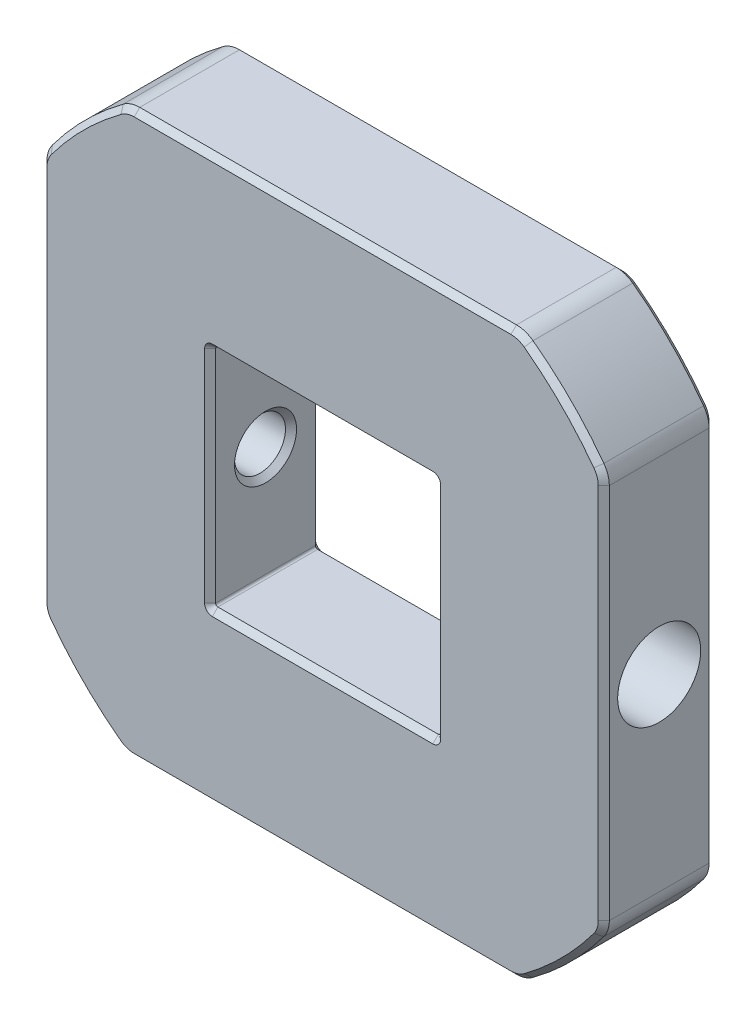
from build123d import *

# Parameters (mm, degrees)
SKIZZE1_W                       = 20.3
SKIZZE1_H                       = 20.3
AUFSATZ_LINEAR_AUSTRAGEN1_DEPTH = 10
VERRUNDUNG1_R                   = 0.2
VERRUNDUNG2_R                   = 2.5
SKIZZE2_R                       = 2.3
SCHNITT_LINEAR_AUSTRAGEN1_DEPTH = 58.614695391
SKETCH1_R                       = 3.75
CUT_EXTRUDE1_DEPTH              = 8.025
CUT_EXTRUDE2_START              = -42.725
SKETCH1_2_R                     = 3.75
CUT_EXTRUDE2_DEPTH              = 8.025
FASE2_SIZE                      = 0.5


with BuildPart() as part:
    # Skizze1 → Aufsatz-Linear austragen1 (new body)
    with BuildSketch(Plane.XY):
        with BuildLine():
            Line((17.807565106, 25.375), (-17.807565106, 25.375))
            ThreePointArc((-17.807565106, 25.375), (-21.920310217, 21.920310217), (-25.375, 17.807565106))
            Line((-25.375, 17.807565106), (-25.375, -17.807565106))
            ThreePointArc((-25.375, -17.807565106), (-21.920310217, -21.920310217), (-17.807565106, -25.375))
            Line((-17.807565106, -25.375), (17.807565106, -25.375))
            ThreePointArc((17.807565106, -25.375), (21.920310217, -21.920310217), (25.375, -17.807565106))
            Line((25.375, -17.807565106), (25.375, 17.807565106))
            ThreePointArc((25.375, 17.807565106), (21.920310217, 21.920310217), (17.807565106, 25.375))
        make_face()
        Rectangle(SKIZZE1_W, SKIZZE1_H, mode=Mode.SUBTRACT)
    extrude(amount=AUFSATZ_LINEAR_AUSTRAGEN1_DEPTH)

    # Verrundung1
    verrundung1_edges = [part.edges().sort_by_distance(p)[0] for p in [
        (10.15, -10.15, 5),
        (10.15, 10.15, 5),
        (-10.15, 10.15, 5),
        (-10.15, -10.15, 5),
    ]]
    fillet(verrundung1_edges, radius=VERRUNDUNG1_R)

    # Verrundung2
    verrundung2_edges = [part.edges().sort_by_distance(p)[0] for p in [
        (25.375, 17.807565106, 5),
        (25.375, -17.807565106, 5),
        (17.807565106, -25.375, 5),
        (-17.807565106, -25.375, 5),
        (-25.375, -17.807565106, 5),
        (-25.375, 17.807565106, 5),
        (-17.807565106, 25.375, 5),
        (17.807565106, 25.375, 5),
    ]]
    fillet(verrundung2_edges, radius=VERRUNDUNG2_R)

    # Skizze2 → Schnitt-Linear austragen1 (cut, through all)
    with BuildSketch(Plane(origin=(25.375, 0, 0), x_dir=(0, 0, -1), z_dir=(1, 0, 0))):
        with Locations(Location((-5, 0, 0), (0, 0, 90))):
            Circle(SKIZZE2_R)
    extrude(amount=-SCHNITT_LINEAR_AUSTRAGEN1_DEPTH, mode=Mode.SUBTRACT)

    # Sketch1 → Cut-Extrude1 (cut)
    with BuildSketch(Plane.ZY.offset(25.375)):
        with Locations((5, 0)):
            Circle(SKETCH1_R)
    extrude(amount=-CUT_EXTRUDE1_DEPTH, mode=Mode.SUBTRACT)

    # Sketch1<2> → Cut-Extrude2 (cut)
    with BuildSketch(Plane.ZY.offset(25.375).offset(CUT_EXTRUDE2_START)):
        with Locations((5, 0)):
            Circle(SKETCH1_2_R)
    extrude(amount=-CUT_EXTRUDE2_DEPTH, mode=Mode.SUBTRACT)

    # Fase2
    fase2_edges = [part.edges().sort_by_distance(p)[0] for p in [
        (-10.15, -2.3, 5),
        (10.15, -2.3, 5),
        (-17.35, -2.3, 5),
        (17.35, -2.3, 5),
        (0, -10.15, 0),
        (0, -10.15, 10),
        (10.15, 0, 0),
        (10.15, 0, 10),
        (-10.15, 0, 0),
        (-10.15, 0, 10),
        (0, 10.15, 0),
        (0, 10.15, 10),
        (10.091421356, -10.091421356, 0),
        (10.091421356, -10.091421356, 10),
        (-10.091421356, -10.091421356, 0),
        (-10.091421356, -10.091421356, 10),
        (-10.091421356, 10.091421356, 0),
        (-10.091421356, 10.091421356, 10),
        (10.091421356, 10.091421356, 0),
        (10.091421356, 10.091421356, 10),
        (0, 25.375, 0),
        (0, 25.375, 10),
        (21.920310217, 21.920310217, 0),
        (25.375, 0, 0),
        (21.920310217, -21.920310217, 0),
        (0, -25.375, 0),
        (-21.920310217, -21.920310217, 0),
        (-25.375, 0, 0),
        (-21.920310217, 21.920310217, 0),
        (-17.784891513, 25.248441317, 0),
        (-25.248441317, 17.784891513, 0),
        (-25.248441317, -17.784891513, 0),
        (-17.784891513, -25.248441317, 0),
        (17.784891513, -25.248441317, 0),
        (25.248441317, -17.784891513, 0),
        (25.248441317, 17.784891513, 0),
        (17.784891513, 25.248441317, 0),
        (21.920310217, 21.920310217, 10),
        (-21.920310217, 21.920310217, 10),
        (-25.375, 0, 10),
        (-21.920310217, -21.920310217, 10),
        (0, -25.375, 10),
        (21.920310217, -21.920310217, 10),
        (25.375, 0, 10),
        (-17.784891513, 25.248441317, 10),
        (-25.248441317, 17.784891513, 10),
        (-25.248441317, -17.784891513, 10),
        (-17.784891513, -25.248441317, 10),
        (17.784891513, -25.248441317, 10),
        (25.248441317, -17.784891513, 10),
        (25.248441317, 17.784891513, 10),
        (17.784891513, 25.248441317, 10),
    ]]
    chamfer(fase2_edges, length=FASE2_SIZE)


solid = part.part
